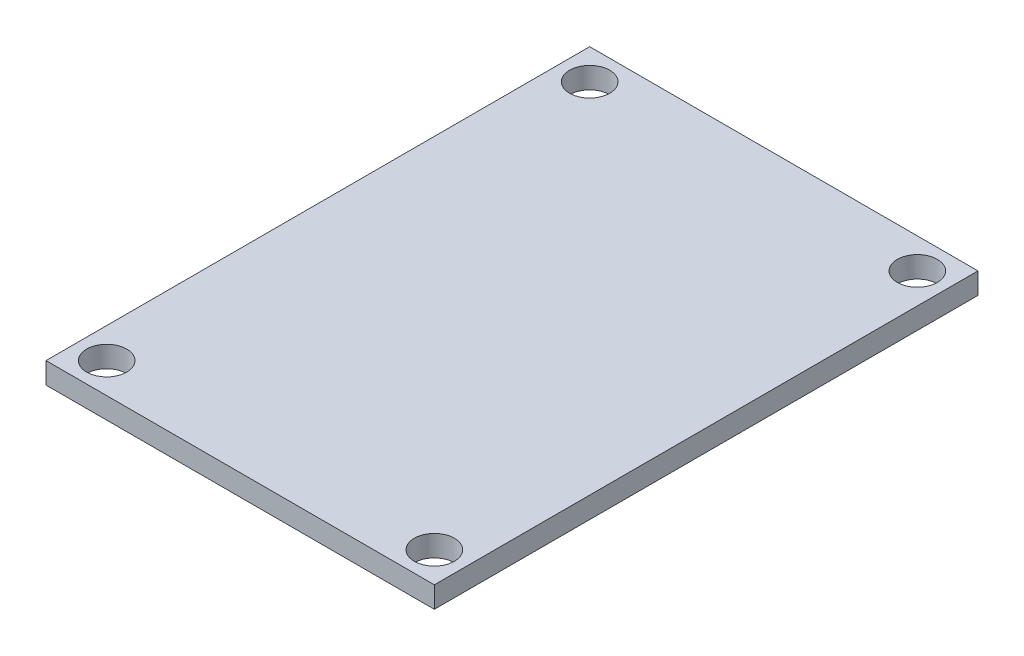
from build123d import *

# Parameters (mm, degrees)
CROQUIS1_W              = 32
CROQUIS1_H              = 44.8
CROQUIS1_R              = 1.65
SALIENTE_EXTRUIR1_DEPTH = 1.75


with BuildPart() as part:
    # Croquis1 → Saliente-Extruir1 (new body)
    with BuildSketch(Plane(origin=(0, 0, 0), x_dir=(1, 0, 0), z_dir=(0, 1, 0))):
        Rectangle(CROQUIS1_W, CROQUIS1_H)
        with Locations(Location((-13.5, 19.9, 0), (0, 0, 270))):
            Circle(CROQUIS1_R, mode=Mode.SUBTRACT)
        with Locations(Location((13.5, 19.9, 0), (0, 0, 90))):
            Circle(CROQUIS1_R, mode=Mode.SUBTRACT)
        with Locations(Location((13.5, -19.9, 0), (0, 0, 270))):
            Circle(CROQUIS1_R, mode=Mode.SUBTRACT)
        with Locations(Location((-13.5, -19.9, 0), (0, 0, 90))):
            Circle(CROQUIS1_R, mode=Mode.SUBTRACT)
    extrude(amount=SALIENTE_EXTRUIR1_DEPTH)


solid = part.part
